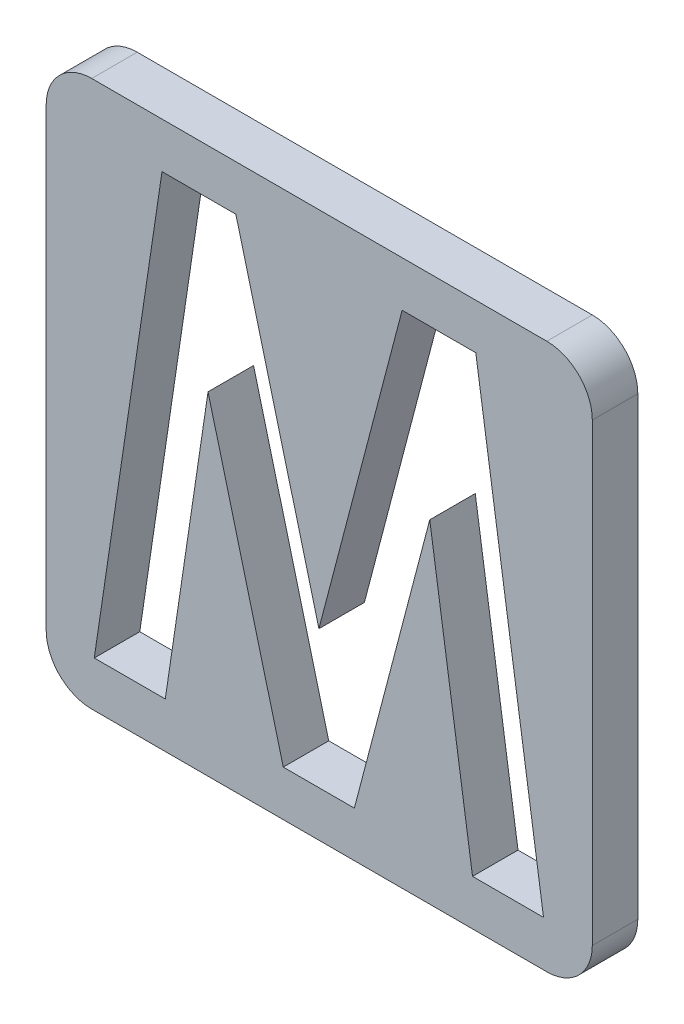
from build123d import *

# Parameters (mm, degrees)
BOSS_EXTRUDE1_DEPTH = 10
CUT_EXTRUDE26_DEPTH = 10


with BuildPart() as part:
    # Sketch1 → Boss-Extrude1 (new body)
    with BuildSketch(Plane.XY):
        with BuildLine():
            Line((-50, 60), (50, 60))
            ThreePointArc((50, 60), (57.071067812, 57.071067812), (60, 50))
            Line((60, 50), (60, -50))
            ThreePointArc((60, -50), (57.071067812, -57.071067812), (50, -60))
            Line((50, -60), (-50, -60))
            ThreePointArc((-50, -60), (-57.071067812, -57.071067812), (-60, -50))
            Line((-60, -50), (-60, 50))
            ThreePointArc((-60, 50), (-57.071067812, 57.071067812), (-50, 60))
        make_face()
    extrude(amount=BOSS_EXTRUDE1_DEPTH)

    # Sketch2 → Cut-Extrude26 (cut)
    with BuildSketch(Plane.XY.offset(10)):
        Polygon((-34.552083333, 50), (-18.326121795, 50), (-0.076923077, -19.751602564), (18.212339744, 50), (34.398237179, 50), (49.282051282, -50), (33.677083333, -50), (24.282051282, 13.161057692), (7.715544872, -50), (-7.909455128, -50), (-24.435897436, 13.161057692), (-33.830929487, -50), (-49.435897436, -50), align=None)
    extrude(amount=-CUT_EXTRUDE26_DEPTH, mode=Mode.SUBTRACT)


solid = part.part
